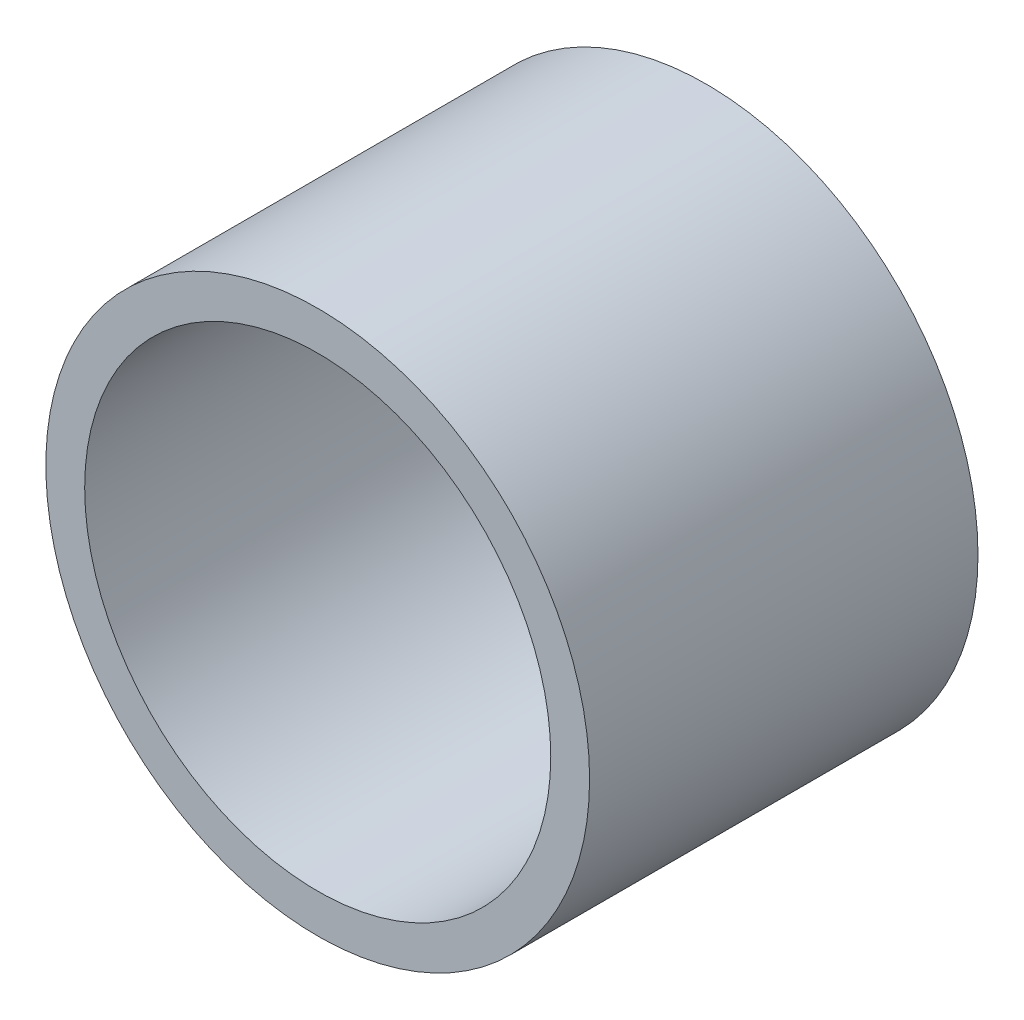
from build123d import *

# Parameters (mm, degrees)
SKETCH_1_R      = 3.5
SKETCH_1_R_2    = 3
EXTRUDE_1_DEPTH = 5


with BuildPart() as part:
    # Эскиз1 → Бобышка-Вытянуть1 (new body)
    with BuildSketch(Plane.XY):
        Circle(SKETCH_1_R)
        Circle(SKETCH_1_R_2, mode=Mode.SUBTRACT)
    extrude(amount=EXTRUDE_1_DEPTH)


solid = part.part
